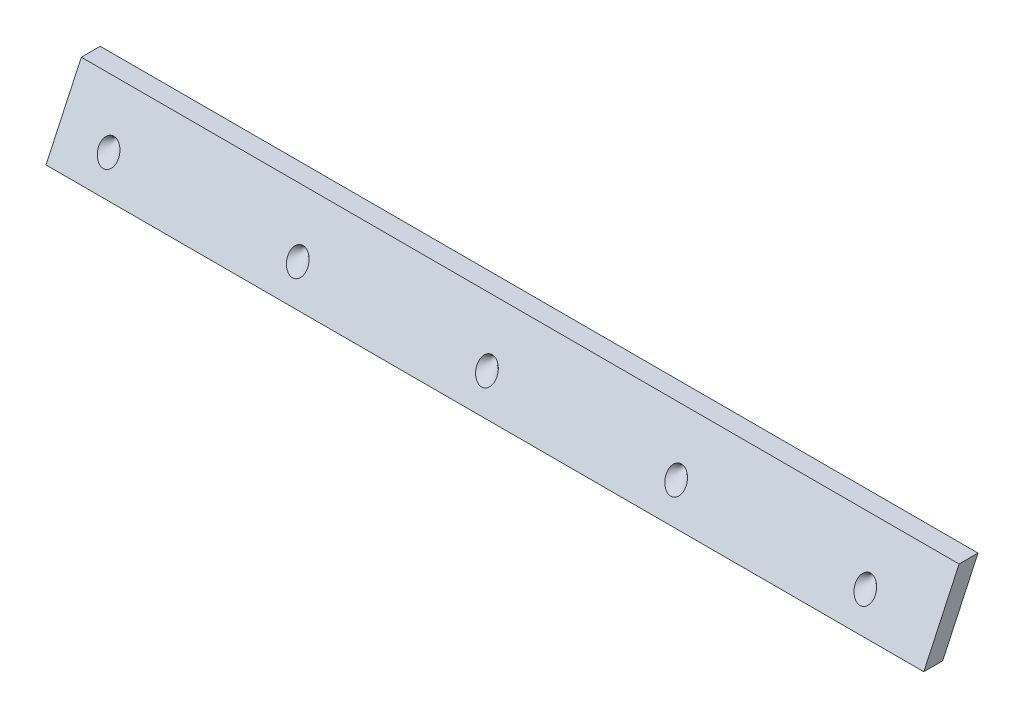
from build123d import *

# Parameters (mm, degrees)
BOSS_EXTRUDE1_DEPTH = 116
LPATTERN1_COUNT     = 5
LPATTERN1_PITCH     = 50


with BuildPart() as part:
    # Sketch1 → Boss-Extrude1 (new, symmetric)
    with BuildSketch(Plane(origin=(0, 0, 0), x_dir=(0, 0, -1), z_dir=(1, 0, 0))):
        Polygon((0, 0), (9.326153163099908, 19.999999999999996), (4.326153163099911, 19.999999999999996), (-5.000000000000001, -8.7e-16), align=None)
    extrude(amount=BOSS_EXTRUDE1_DEPTH, both=True)

    # Sketch3 → Cut-Revolve1 (revolve, cut)
    with BuildSketch(Plane.ZY.offset(103.00000000000001)):
        Polygon((-1.5444404272329906, 8.999999999999998), (2.854482547232013, 4.601077025535014), (0.8032310766050411, 8.999999999999998), align=None)
    cut_revolve1 = revolve(axis=Axis((-103.00000000000001, 9.000000000000002, 9.024012903581264), (0, -1.5e-16, -1)), mode=Mode.SUBTRACT)

    # LPattern1: Cut-Revolve1 ×5
    with Locations(*[(i * LPATTERN1_PITCH, 0, 0) for i in range(1, LPATTERN1_COUNT)]):
        add(cut_revolve1, mode=Mode.SUBTRACT)


solid = part.part
